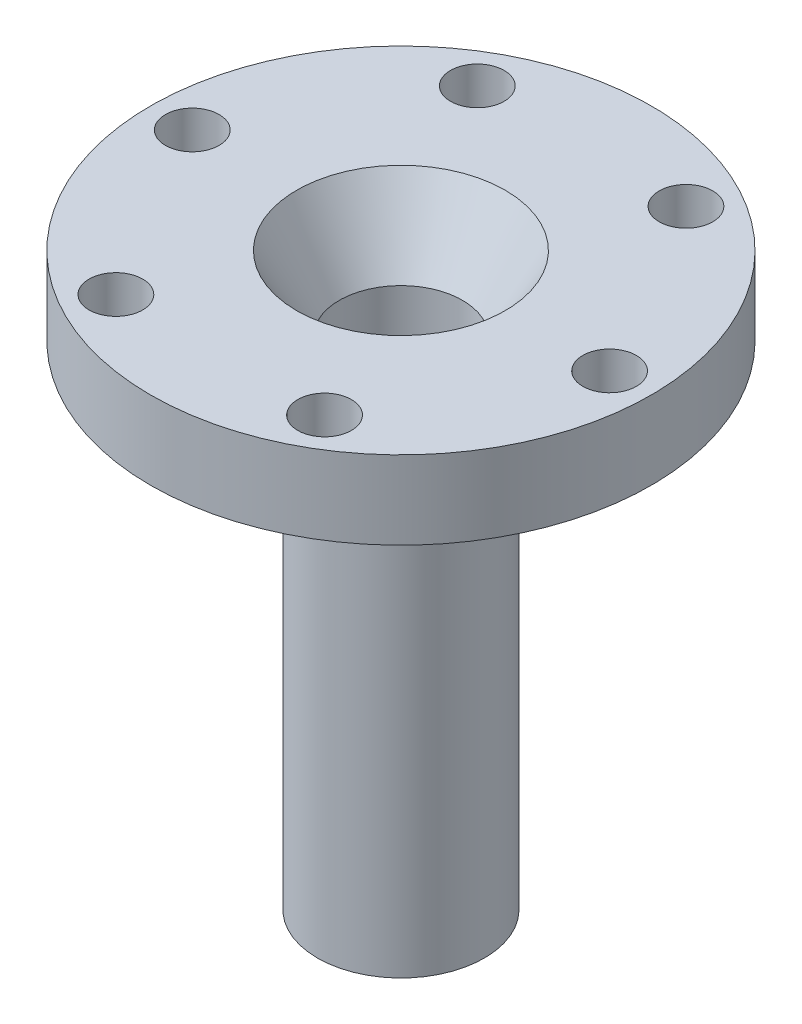
from build123d import *

# Parameters (mm, degrees)
F_1_4_CLEARANCE_HOLE1_D = 6.5278
CIRPATTERN1_COUNT       = 6
CHAMFER1_SIZE           = 2.032
CHAMFER1_SIZE2          = 0.820981291
FILLET1_R               = 0.79375
CHAMFER2_SIZE           = 3.175


with BuildPart() as part:
    # Sketch1 → Revolve1 (revolve)
    with BuildSketch(Plane.XY, mode=Mode.PRIVATE) as revolve1_sk:
        Polygon((7.5, -69.525), (7.5, -9.006664199), (12.7, 0), (30.48, 0), (30.48, -9.525), (10.16, -9.525), (10.16, -69.525), align=None)
    revolve(revolve1_sk.sketch.rotate(Axis((0, 0, 0), (0, -1, 0)), 90), axis=Axis((0, 0, 0), (0, -1, 0)))

    # 1/4 Clearance Hole1 (through all)
    with Locations(Plane(origin=(0, 0, 0), x_dir=(1, 0, 0), z_dir=(0, 1, 0))):
        with Locations((25.4, 0)):
            f_1_4_clearance_hole1 = Hole(F_1_4_CLEARANCE_HOLE1_D / 2)

    # CirPattern1: 1/4 Clearance Hole1 ×6 about axis
    cirpattern1_axis = Axis((0, 0, 0), (0, 1, 0))
    for i in range(1, CIRPATTERN1_COUNT):
        add(f_1_4_clearance_hole1.rotate(cirpattern1_axis, i * 360 / CIRPATTERN1_COUNT), mode=Mode.SUBTRACT)

    # Chamfer1
    chamfer1_edges = [part.edges().sort_by_distance(p)[0] for p in [
        (0, -69.525, -7.5),
    ]]
    chamfer1_side = [part.faces().sort_by_distance(p)[0] for p in [
        (0, -69.525, -9.872631804),
    ]]
    chamfer(chamfer1_edges, length=CHAMFER1_SIZE, length2=CHAMFER1_SIZE2, reference=chamfer1_side[0])

    # Fillet1
    fillet1_edges = [part.edges().sort_by_distance(p)[0] for p in [
        (0, -68.704018709, -7.5),
    ]]
    fillet(fillet1_edges, radius=FILLET1_R)

    # Chamfer2
    chamfer2_edges = [part.edges().sort_by_distance(p)[0] for p in [
        (0, -9.525, -10.16),
    ]]
    chamfer(chamfer2_edges, length=CHAMFER2_SIZE)


solid = part.part
